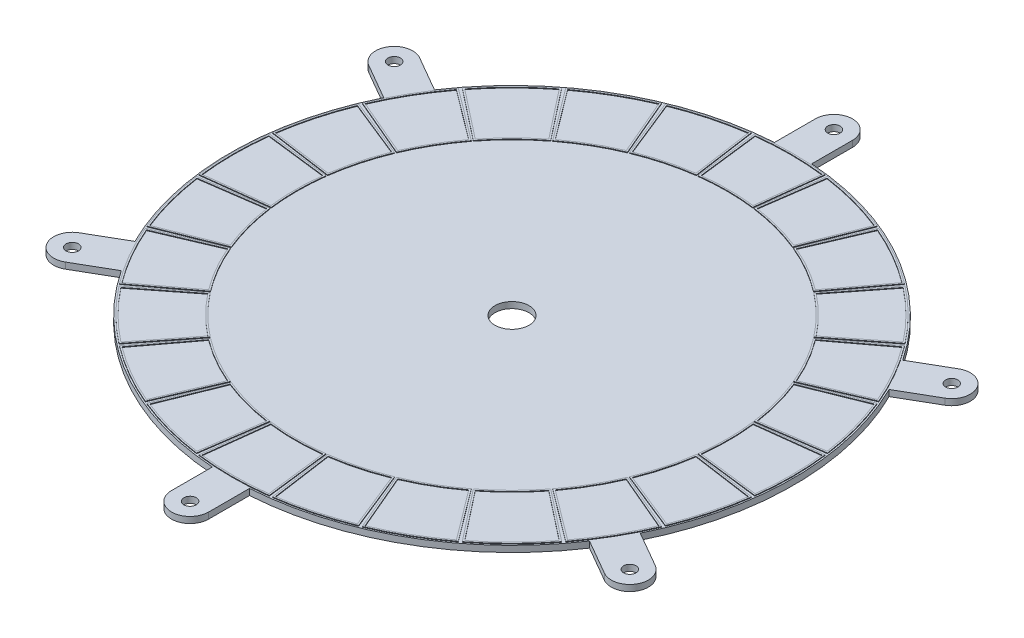
from build123d import *

# Parameters (mm, degrees)
SKETCH1_R           = 10
SKETCH1_R_2         = 27.5
BOSS_EXTRUDE1_DEPTH = 5
BOSS_EXTRUDE3_DEPTH = 1


with BuildPart() as part:
    # Sketch1 → Boss-Extrude1 (new, symmetric)
    with BuildSketch(Plane(origin=(0, 0, 0), x_dir=(1, 0, 0), z_dir=(0, 1, 0))):
        with BuildLine():
            Line((-30, 454.009911786), (-30, 520))
            ThreePointArc((-30, 520), (0, 550), (30, 520))
            Line((30, 520), (30, 454.009911786))
            ThreePointArc((30, 454.009911786), (227.5, 394.041558722), (378.184117177, 252.985718007))
            Line((378.184117177, 252.985718007), (435.333209968, 285.980762114))
            ThreePointArc((435.333209968, 285.980762114), (476.313972081, 275), (465.333209968, 234.019237886))
            Line((465.333209968, 234.019237886), (408.184117177, 201.02419378))
            ThreePointArc((408.184117177, 201.02419378), (455, 0), (408.184117177, -201.02419378))
            Line((408.184117177, -201.02419378), (465.333209968, -234.019237886))
            ThreePointArc((465.333209968, -234.019237886), (476.313972081, -275), (435.333209968, -285.980762114))
            Line((435.333209968, -285.980762114), (378.184117177, -252.985718007))
            ThreePointArc((378.184117177, -252.985718007), (227.5, -394.041558722), (30, -454.009911786))
            Line((30, -454.009911786), (30, -520))
            ThreePointArc((30, -520), (0, -550), (-30, -520))
            Line((-30, -520), (-30, -454.009911786))
            ThreePointArc((-30, -454.009911786), (-227.5, -394.041558722), (-378.184117177, -252.985718007))
            Line((-378.184117177, -252.985718007), (-435.333209968, -285.980762114))
            ThreePointArc((-435.333209968, -285.980762114), (-476.313972081, -275), (-465.333209968, -234.019237886))
            Line((-465.333209968, -234.019237886), (-408.184117177, -201.02419378))
            ThreePointArc((-408.184117177, -201.02419378), (-455, 0), (-408.184117177, 201.02419378))
            Line((-408.184117177, 201.02419378), (-465.333209968, 234.019237886))
            ThreePointArc((-465.333209968, 234.019237886), (-476.313972081, 275), (-435.333209968, 285.980762114))
            Line((-435.333209968, 285.980762114), (-378.184117177, 252.985718007))
            ThreePointArc((-378.184117177, 252.985718007), (-227.5, 394.041558722), (-30, 454.009911786))
        make_face()
        with Locations(Location((0, 520, 0), (0, 0, 270))):
            Circle(SKETCH1_R, mode=Mode.SUBTRACT)
        with Locations(Location((450.333209968, 260, 0), (0, 0, 270))):
            Circle(SKETCH1_R, mode=Mode.SUBTRACT)
        with Locations(Location((450.333209968, -260, 0), (0, 0, 270))):
            Circle(SKETCH1_R, mode=Mode.SUBTRACT)
        with Locations(Location((0, -520, 0), (0, 0, 270))):
            Circle(SKETCH1_R, mode=Mode.SUBTRACT)
        with Locations(Location((-450.333209968, -260, 0), (0, 0, 270))):
            Circle(SKETCH1_R, mode=Mode.SUBTRACT)
        with Locations(Location((-450.333209968, 260, 0), (0, 0, 270))):
            Circle(SKETCH1_R, mode=Mode.SUBTRACT)
        with Locations(Location((0, 0, 0), (0, 0, 270))):
            Circle(SKETCH1_R_2, mode=Mode.SUBTRACT)
    extrude(amount=BOSS_EXTRUDE1_DEPTH, both=True)

    # Sketch3 → Boss-Extrude3 (add)
    # profile 1 of 24: a face of its own
    with BuildSketch(Plane(origin=(0, 5, 0), x_dir=(1, 0, 0), z_dir=(0, 1, 0))):
        with BuildLine():
            Line((-56.781105994, 448.923329759), (-44.180855579, 344.67999942))
            ThreePointArc((-44.180855579, 344.67999942), (0, 347.5), (44.180855579, 344.67999942))
            Line((44.180855579, 344.67999942), (56.781105994, 448.923329759))
            ThreePointArc((56.781105994, 448.923329759), (0, 452.5), (-56.781105994, 448.923329759))
        make_face()
        with BuildLine():
            Line((-54, 446.748251256), (-42, 347.470862088))
            ThreePointArc((-42, 347.470862088), (0, 350), (42, 347.470862088))
            Line((42, 347.470862088), (54, 446.748251256))
            ThreePointArc((54, 446.748251256), (0, 450), (-54, 446.748251256))
        make_face(mode=Mode.SUBTRACT)
    # profile 2 of 24: a face of its own
    with BuildSketch(Plane(origin=(0, 5, 0), x_dir=(1, 0, 0), z_dir=(0, 1, 0))):
        with BuildLine():
            Line((61.343570808, 448.322669871), (46.534318885, 344.370160098))
            ThreePointArc((46.534318885, 344.370160098), (89.939618173, 335.659224635), (131.885177747, 321.500466393))
            Line((131.885177747, 321.500466393), (171.036244257, 418.930606605))
            ThreePointArc((171.036244257, 418.930606605), (117.115617909, 437.081436396), (61.343570808, 448.322669871))
        make_face()
        with BuildLine():
            Line((63.466961172, 445.501902173), (49.363192022, 346.501479468))
            ThreePointArc((49.363192022, 346.501479468), (90.586665786, 338.074039201), (130.500961431, 324.760679679))
            Line((130.500961431, 324.760679679), (167.786950411, 417.549445302))
            ThreePointArc((167.786950411, 417.549445302), (116.468570296, 434.66662183), (63.466961172, 445.501902173))
        make_face(mode=Mode.SUBTRACT)
    # profile 3 of 24: a face of its own
    with BuildSketch(Plane(origin=(0, 5, 0), x_dir=(1, 0, 0), z_dir=(0, 1, 0))):
        with BuildLine():
            Line((175.287784634, 417.16956092), (134.078256418, 320.592063464))
            ThreePointArc((134.078256418, 320.592063464), (173.75, 300.943827815), (210.601743002, 276.411207885))
            Line((210.601743002, 276.411207885), (273.635545125, 360.388454926))
            ThreePointArc((273.635545125, 360.388454926), (226.25, 391.876495212), (175.287784634, 417.16956092))
        make_face()
        with BuildLine():
            Line((176.608753823, 413.895334684), (137.362364085, 321.918593643))
            ThreePointArc((137.362364085, 321.918593643), (175, 303.108891325), (210.108498003, 279.918593643))
            Line((210.108498003, 279.918593643), (270.139497432, 359.895334684))
            ThreePointArc((270.139497432, 359.895334684), (225, 389.711431703), (176.608753823, 413.895334684))
        make_face(mode=Mode.SUBTRACT)
    # profile 4 of 24: a face of its own
    with BuildSketch(Plane(origin=(0, 5, 0), x_dir=(1, 0, 0), z_dir=(0, 1, 0))):
        with BuildLine():
            Line((277.286425614, 357.587035797), (212.484982351, 274.966147508))
            ThreePointArc((212.484982351, 274.966147508), (245.719606462, 245.719606462), (274.966147508, 212.484982351))
            Line((274.966147508, 212.484982351), (357.587035797, 277.286425614))
            ThreePointArc((357.587035797, 277.286425614), (319.965818487, 319.965818487), (277.286425614, 357.587035797))
        make_face()
        with BuildLine():
            Line((277.714951762, 354.08248413), (216.000518037, 275.397487657))
            ThreePointArc((216.000518037, 275.397487657), (247.487373415, 247.487373415), (275.397487657, 216.000518037))
            Line((275.397487657, 216.000518037), (354.08248413, 277.714951762))
            ThreePointArc((354.08248413, 277.714951762), (318.198051534, 318.198051534), (277.714951762, 354.08248413))
        make_face(mode=Mode.SUBTRACT)
    # profile 5 of 24: a face of its own
    with BuildSketch(Plane(origin=(0, 5, 0), x_dir=(1, 0, 0), z_dir=(0, 1, 0))):
        with BuildLine():
            Line((360.388454926, 273.635545125), (276.411207885, 210.601743002))
            ThreePointArc((276.411207885, 210.601743002), (300.943827815, 173.75), (320.592063464, 134.078256418))
            Line((320.592063464, 134.078256418), (417.16956092, 175.287784634))
            ThreePointArc((417.16956092, 175.287784634), (391.876495212, 226.25), (360.388454926, 273.635545125))
        make_face()
        with BuildLine():
            Line((359.895334684, 270.139497432), (279.918593643, 210.108498003))
            ThreePointArc((279.918593643, 210.108498003), (303.108891325, 175), (321.918593643, 137.362364085))
            Line((321.918593643, 137.362364085), (413.895334684, 176.608753823))
            ThreePointArc((413.895334684, 176.608753823), (389.711431703, 225), (359.895334684, 270.139497432))
        make_face(mode=Mode.SUBTRACT)
    # profile 6 of 24: a face of its own
    with BuildSketch(Plane(origin=(0, 5, 0), x_dir=(1, 0, 0), z_dir=(0, 1, 0))):
        with BuildLine():
            Line((418.930606605, 171.036244257), (321.500466393, 131.885177747))
            ThreePointArc((321.500466393, 131.885177747), (335.659224635, 89.939618173), (344.370160098, 46.534318885))
            Line((344.370160098, 46.534318885), (448.322669871, 61.343570808))
            ThreePointArc((448.322669871, 61.343570808), (437.081436396, 117.115617909), (418.930606605, 171.036244257))
        make_face()
        with BuildLine():
            Line((417.549445302, 167.786950411), (324.760679679, 130.500961431))
            ThreePointArc((324.760679679, 130.500961431), (338.074039201, 90.586665786), (346.501479468, 49.363192022))
            Line((346.501479468, 49.363192022), (445.501902173, 63.466961172))
            ThreePointArc((445.501902173, 63.466961172), (434.66662183, 116.468570296), (417.549445302, 167.786950411))
        make_face(mode=Mode.SUBTRACT)
    # profile 7 of 24: a face of its own
    with BuildSketch(Plane(origin=(0, 5, 0), x_dir=(1, 0, 0), z_dir=(0, 1, 0))):
        with BuildLine():
            Line((448.923329759, 56.781105994), (344.67999942, 44.180855579))
            ThreePointArc((344.67999942, 44.180855579), (347.5, 0), (344.67999942, -44.180855579))
            Line((344.67999942, -44.180855579), (448.923329759, -56.781105994))
            ThreePointArc((448.923329759, -56.781105994), (452.5, 0), (448.923329759, 56.781105994))
        make_face()
        with BuildLine():
            Line((446.748251256, 54), (347.470862088, 42))
            ThreePointArc((347.470862088, 42), (350, 0), (347.470862088, -42))
            Line((347.470862088, -42), (446.748251256, -54))
            ThreePointArc((446.748251256, -54), (450, 0), (446.748251256, 54))
        make_face(mode=Mode.SUBTRACT)
    # profile 8 of 24: a face of its own
    with BuildSketch(Plane(origin=(0, 5, 0), x_dir=(1, 0, 0), z_dir=(0, 1, 0))):
        with BuildLine():
            Line((448.322669871, -61.343570808), (344.370160098, -46.534318885))
            ThreePointArc((344.370160098, -46.534318885), (335.659224635, -89.939618173), (321.500466393, -131.885177747))
            Line((321.500466393, -131.885177747), (418.930606605, -171.036244257))
            ThreePointArc((418.930606605, -171.036244257), (437.081436396, -117.115617909), (448.322669871, -61.343570808))
        make_face()
        with BuildLine():
            Line((445.501902173, -63.466961172), (346.501479468, -49.363192022))
            ThreePointArc((346.501479468, -49.363192022), (338.074039201, -90.586665786), (324.760679679, -130.500961431))
            Line((324.760679679, -130.500961431), (417.549445302, -167.786950411))
            ThreePointArc((417.549445302, -167.786950411), (434.66662183, -116.468570296), (445.501902173, -63.466961172))
        make_face(mode=Mode.SUBTRACT)
    # profile 9 of 24: a face of its own
    with BuildSketch(Plane(origin=(0, 5, 0), x_dir=(1, 0, 0), z_dir=(0, 1, 0))):
        with BuildLine():
            Line((417.16956092, -175.287784634), (320.592063464, -134.078256418))
            ThreePointArc((320.592063464, -134.078256418), (300.943827815, -173.75), (276.411207885, -210.601743002))
            Line((276.411207885, -210.601743002), (360.388454926, -273.635545125))
            ThreePointArc((360.388454926, -273.635545125), (391.876495212, -226.25), (417.16956092, -175.287784634))
        make_face()
        with BuildLine():
            Line((413.895334684, -176.608753823), (321.918593643, -137.362364085))
            ThreePointArc((321.918593643, -137.362364085), (303.108891325, -175), (279.918593643, -210.108498003))
            Line((279.918593643, -210.108498003), (359.895334684, -270.139497432))
            ThreePointArc((359.895334684, -270.139497432), (389.711431703, -225), (413.895334684, -176.608753823))
        make_face(mode=Mode.SUBTRACT)
    # profile 10 of 24: a face of its own
    with BuildSketch(Plane(origin=(0, 5, 0), x_dir=(1, 0, 0), z_dir=(0, 1, 0))):
        with BuildLine():
            Line((357.587035797, -277.286425614), (274.966147508, -212.484982351))
            ThreePointArc((274.966147508, -212.484982351), (245.719606462, -245.719606462), (212.484982351, -274.966147508))
            Line((212.484982351, -274.966147508), (277.286425614, -357.587035797))
            ThreePointArc((277.286425614, -357.587035797), (319.965818487, -319.965818487), (357.587035797, -277.286425614))
        make_face()
        with BuildLine():
            Line((354.08248413, -277.714951762), (275.397487657, -216.000518037))
            ThreePointArc((275.397487657, -216.000518037), (247.487373415, -247.487373415), (216.000518037, -275.397487657))
            Line((216.000518037, -275.397487657), (277.714951762, -354.08248413))
            ThreePointArc((277.714951762, -354.08248413), (318.198051534, -318.198051534), (354.08248413, -277.714951762))
        make_face(mode=Mode.SUBTRACT)
    # profile 11 of 24: a face of its own
    with BuildSketch(Plane(origin=(0, 5, 0), x_dir=(1, 0, 0), z_dir=(0, 1, 0))):
        with BuildLine():
            Line((273.635545125, -360.388454926), (210.601743002, -276.411207885))
            ThreePointArc((210.601743002, -276.411207885), (173.75, -300.943827815), (134.078256418, -320.592063464))
            Line((134.078256418, -320.592063464), (175.287784634, -417.16956092))
            ThreePointArc((175.287784634, -417.16956092), (226.25, -391.876495212), (273.635545125, -360.388454926))
        make_face()
        with BuildLine():
            Line((270.139497432, -359.895334684), (210.108498003, -279.918593643))
            ThreePointArc((210.108498003, -279.918593643), (175, -303.108891325), (137.362364085, -321.918593643))
            Line((137.362364085, -321.918593643), (176.608753823, -413.895334684))
            ThreePointArc((176.608753823, -413.895334684), (225, -389.711431703), (270.139497432, -359.895334684))
        make_face(mode=Mode.SUBTRACT)
    # profile 12 of 24: a face of its own
    with BuildSketch(Plane(origin=(0, 5, 0), x_dir=(1, 0, 0), z_dir=(0, 1, 0))):
        with BuildLine():
            Line((171.036244257, -418.930606605), (131.885177747, -321.500466393))
            ThreePointArc((131.885177747, -321.500466393), (89.939618173, -335.659224635), (46.534318885, -344.370160098))
            Line((46.534318885, -344.370160098), (61.343570808, -448.322669871))
            ThreePointArc((61.343570808, -448.322669871), (117.115617909, -437.081436396), (171.036244257, -418.930606605))
        make_face()
        with BuildLine():
            Line((167.786950411, -417.549445302), (130.500961431, -324.760679679))
            ThreePointArc((130.500961431, -324.760679679), (90.586665786, -338.074039201), (49.363192022, -346.501479468))
            Line((49.363192022, -346.501479468), (63.466961172, -445.501902173))
            ThreePointArc((63.466961172, -445.501902173), (116.468570296, -434.66662183), (167.786950411, -417.549445302))
        make_face(mode=Mode.SUBTRACT)
    # profile 13 of 24: a face of its own
    with BuildSketch(Plane(origin=(0, 5, 0), x_dir=(1, 0, 0), z_dir=(0, 1, 0))):
        with BuildLine():
            Line((56.781105994, -448.923329759), (44.180855579, -344.67999942))
            ThreePointArc((44.180855579, -344.67999942), (0, -347.5), (-44.180855579, -344.67999942))
            Line((-44.180855579, -344.67999942), (-56.781105994, -448.923329759))
            ThreePointArc((-56.781105994, -448.923329759), (0, -452.5), (56.781105994, -448.923329759))
        make_face()
        with BuildLine():
            Line((54, -446.748251256), (42, -347.470862088))
            ThreePointArc((42, -347.470862088), (0, -350), (-42, -347.470862088))
            Line((-42, -347.470862088), (-54, -446.748251256))
            ThreePointArc((-54, -446.748251256), (0, -450), (54, -446.748251256))
        make_face(mode=Mode.SUBTRACT)
    # profile 14 of 24: a face of its own
    with BuildSketch(Plane(origin=(0, 5, 0), x_dir=(1, 0, 0), z_dir=(0, 1, 0))):
        with BuildLine():
            Line((-61.343570808, -448.322669871), (-46.534318885, -344.370160098))
            ThreePointArc((-46.534318885, -344.370160098), (-89.939618173, -335.659224635), (-131.885177747, -321.500466393))
            Line((-131.885177747, -321.500466393), (-171.036244257, -418.930606605))
            ThreePointArc((-171.036244257, -418.930606605), (-117.115617909, -437.081436396), (-61.343570808, -448.322669871))
        make_face()
        with BuildLine():
            Line((-63.466961172, -445.501902173), (-49.363192022, -346.501479468))
            ThreePointArc((-49.363192022, -346.501479468), (-90.586665786, -338.074039201), (-130.500961431, -324.760679679))
            Line((-130.500961431, -324.760679679), (-167.786950411, -417.549445302))
            ThreePointArc((-167.786950411, -417.549445302), (-116.468570296, -434.66662183), (-63.466961172, -445.501902173))
        make_face(mode=Mode.SUBTRACT)
    # profile 15 of 24: a face of its own
    with BuildSketch(Plane(origin=(0, 5, 0), x_dir=(1, 0, 0), z_dir=(0, 1, 0))):
        with BuildLine():
            Line((-175.287784634, -417.16956092), (-134.078256418, -320.592063464))
            ThreePointArc((-134.078256418, -320.592063464), (-173.75, -300.943827815), (-210.601743002, -276.411207885))
            Line((-210.601743002, -276.411207885), (-273.635545125, -360.388454926))
            ThreePointArc((-273.635545125, -360.388454926), (-226.25, -391.876495212), (-175.287784634, -417.16956092))
        make_face()
        with BuildLine():
            Line((-176.608753823, -413.895334684), (-137.362364085, -321.918593643))
            ThreePointArc((-137.362364085, -321.918593643), (-175, -303.108891325), (-210.108498003, -279.918593643))
            Line((-210.108498003, -279.918593643), (-270.139497432, -359.895334684))
            ThreePointArc((-270.139497432, -359.895334684), (-225, -389.711431703), (-176.608753823, -413.895334684))
        make_face(mode=Mode.SUBTRACT)
    # profile 16 of 24: a face of its own
    with BuildSketch(Plane(origin=(0, 5, 0), x_dir=(1, 0, 0), z_dir=(0, 1, 0))):
        with BuildLine():
            Line((-277.286425614, -357.587035797), (-212.484982351, -274.966147508))
            ThreePointArc((-212.484982351, -274.966147508), (-245.719606462, -245.719606462), (-274.966147508, -212.484982351))
            Line((-274.966147508, -212.484982351), (-357.587035797, -277.286425614))
            ThreePointArc((-357.587035797, -277.286425614), (-319.965818487, -319.965818487), (-277.286425614, -357.587035797))
        make_face()
        with BuildLine():
            Line((-277.714951762, -354.08248413), (-216.000518037, -275.397487657))
            ThreePointArc((-216.000518037, -275.397487657), (-247.487373415, -247.487373415), (-275.397487657, -216.000518037))
            Line((-275.397487657, -216.000518037), (-354.08248413, -277.714951762))
            ThreePointArc((-354.08248413, -277.714951762), (-318.198051534, -318.198051534), (-277.714951762, -354.08248413))
        make_face(mode=Mode.SUBTRACT)
    # profile 17 of 24: a face of its own
    with BuildSketch(Plane(origin=(0, 5, 0), x_dir=(1, 0, 0), z_dir=(0, 1, 0))):
        with BuildLine():
            Line((-360.388454926, -273.635545125), (-276.411207885, -210.601743002))
            ThreePointArc((-276.411207885, -210.601743002), (-300.943827815, -173.75), (-320.592063464, -134.078256418))
            Line((-320.592063464, -134.078256418), (-417.16956092, -175.287784634))
            ThreePointArc((-417.16956092, -175.287784634), (-391.876495212, -226.25), (-360.388454926, -273.635545125))
        make_face()
        with BuildLine():
            Line((-359.895334684, -270.139497432), (-279.918593643, -210.108498003))
            ThreePointArc((-279.918593643, -210.108498003), (-303.108891325, -175), (-321.918593643, -137.362364085))
            Line((-321.918593643, -137.362364085), (-413.895334684, -176.608753823))
            ThreePointArc((-413.895334684, -176.608753823), (-389.711431703, -225), (-359.895334684, -270.139497432))
        make_face(mode=Mode.SUBTRACT)
    # profile 18 of 24: a face of its own
    with BuildSketch(Plane(origin=(0, 5, 0), x_dir=(1, 0, 0), z_dir=(0, 1, 0))):
        with BuildLine():
            Line((-418.930606605, -171.036244257), (-321.500466393, -131.885177747))
            ThreePointArc((-321.500466393, -131.885177747), (-335.659224635, -89.939618173), (-344.370160098, -46.534318885))
            Line((-344.370160098, -46.534318885), (-448.322669871, -61.343570808))
            ThreePointArc((-448.322669871, -61.343570808), (-437.081436396, -117.115617909), (-418.930606605, -171.036244257))
        make_face()
        with BuildLine():
            Line((-417.549445302, -167.786950411), (-324.760679679, -130.500961431))
            ThreePointArc((-324.760679679, -130.500961431), (-338.074039201, -90.586665786), (-346.501479468, -49.363192022))
            Line((-346.501479468, -49.363192022), (-445.501902173, -63.466961172))
            ThreePointArc((-445.501902173, -63.466961172), (-434.66662183, -116.468570296), (-417.549445302, -167.786950411))
        make_face(mode=Mode.SUBTRACT)
    # profile 19 of 24: a face of its own
    with BuildSketch(Plane(origin=(0, 5, 0), x_dir=(1, 0, 0), z_dir=(0, 1, 0))):
        with BuildLine():
            Line((-448.923329759, -56.781105994), (-344.67999942, -44.180855579))
            ThreePointArc((-344.67999942, -44.180855579), (-347.5, 0), (-344.67999942, 44.180855579))
            Line((-344.67999942, 44.180855579), (-448.923329759, 56.781105994))
            ThreePointArc((-448.923329759, 56.781105994), (-452.5, 0), (-448.923329759, -56.781105994))
        make_face()
        with BuildLine():
            Line((-446.748251256, -54), (-347.470862088, -42))
            ThreePointArc((-347.470862088, -42), (-350, 0), (-347.470862088, 42))
            Line((-347.470862088, 42), (-446.748251256, 54))
            ThreePointArc((-446.748251256, 54), (-450, 0), (-446.748251256, -54))
        make_face(mode=Mode.SUBTRACT)
    # profile 20 of 24: a face of its own
    with BuildSketch(Plane(origin=(0, 5, 0), x_dir=(1, 0, 0), z_dir=(0, 1, 0))):
        with BuildLine():
            Line((-448.322669871, 61.343570808), (-344.370160098, 46.534318885))
            ThreePointArc((-344.370160098, 46.534318885), (-335.659224635, 89.939618173), (-321.500466393, 131.885177747))
            Line((-321.500466393, 131.885177747), (-418.930606605, 171.036244257))
            ThreePointArc((-418.930606605, 171.036244257), (-437.081436396, 117.115617909), (-448.322669871, 61.343570808))
        make_face()
        with BuildLine():
            Line((-445.501902173, 63.466961172), (-346.501479468, 49.363192022))
            ThreePointArc((-346.501479468, 49.363192022), (-338.074039201, 90.586665786), (-324.760679679, 130.500961431))
            Line((-324.760679679, 130.500961431), (-417.549445302, 167.786950411))
            ThreePointArc((-417.549445302, 167.786950411), (-434.66662183, 116.468570296), (-445.501902173, 63.466961172))
        make_face(mode=Mode.SUBTRACT)
    # profile 21 of 24: a face of its own
    with BuildSketch(Plane(origin=(0, 5, 0), x_dir=(1, 0, 0), z_dir=(0, 1, 0))):
        with BuildLine():
            Line((-417.16956092, 175.287784634), (-320.592063464, 134.078256418))
            ThreePointArc((-320.592063464, 134.078256418), (-300.943827815, 173.75), (-276.411207885, 210.601743002))
            Line((-276.411207885, 210.601743002), (-360.388454926, 273.635545125))
            ThreePointArc((-360.388454926, 273.635545125), (-391.876495212, 226.25), (-417.16956092, 175.287784634))
        make_face()
        with BuildLine():
            Line((-413.895334684, 176.608753823), (-321.918593643, 137.362364085))
            ThreePointArc((-321.918593643, 137.362364085), (-303.108891325, 175), (-279.918593643, 210.108498003))
            Line((-279.918593643, 210.108498003), (-359.895334684, 270.139497432))
            ThreePointArc((-359.895334684, 270.139497432), (-389.711431703, 225), (-413.895334684, 176.608753823))
        make_face(mode=Mode.SUBTRACT)
    # profile 22 of 24: a face of its own
    with BuildSketch(Plane(origin=(0, 5, 0), x_dir=(1, 0, 0), z_dir=(0, 1, 0))):
        with BuildLine():
            Line((-357.587035797, 277.286425614), (-274.966147508, 212.484982351))
            ThreePointArc((-274.966147508, 212.484982351), (-245.719606462, 245.719606462), (-212.484982351, 274.966147508))
            Line((-212.484982351, 274.966147508), (-277.286425614, 357.587035797))
            ThreePointArc((-277.286425614, 357.587035797), (-319.965818487, 319.965818487), (-357.587035797, 277.286425614))
        make_face()
        with BuildLine():
            Line((-354.08248413, 277.714951762), (-275.397487657, 216.000518037))
            ThreePointArc((-275.397487657, 216.000518037), (-247.487373415, 247.487373415), (-216.000518037, 275.397487657))
            Line((-216.000518037, 275.397487657), (-277.714951762, 354.08248413))
            ThreePointArc((-277.714951762, 354.08248413), (-318.198051534, 318.198051534), (-354.08248413, 277.714951762))
        make_face(mode=Mode.SUBTRACT)
    # profile 23 of 24: a face of its own
    with BuildSketch(Plane(origin=(0, 5, 0), x_dir=(1, 0, 0), z_dir=(0, 1, 0))):
        with BuildLine():
            Line((-273.635545125, 360.388454926), (-210.601743002, 276.411207885))
            ThreePointArc((-210.601743002, 276.411207885), (-173.75, 300.943827815), (-134.078256418, 320.592063464))
            Line((-134.078256418, 320.592063464), (-175.287784634, 417.16956092))
            ThreePointArc((-175.287784634, 417.16956092), (-226.25, 391.876495212), (-273.635545125, 360.388454926))
        make_face()
        with BuildLine():
            Line((-270.139497432, 359.895334684), (-210.108498003, 279.918593643))
            ThreePointArc((-210.108498003, 279.918593643), (-175, 303.108891325), (-137.362364085, 321.918593643))
            Line((-137.362364085, 321.918593643), (-176.608753823, 413.895334684))
            ThreePointArc((-176.608753823, 413.895334684), (-225, 389.711431703), (-270.139497432, 359.895334684))
        make_face(mode=Mode.SUBTRACT)
    # profile 24 of 24: a face of its own
    with BuildSketch(Plane(origin=(0, 5, 0), x_dir=(1, 0, 0), z_dir=(0, 1, 0))):
        with BuildLine():
            Line((-171.036244257, 418.930606605), (-131.885177747, 321.500466393))
            ThreePointArc((-131.885177747, 321.500466393), (-89.939618173, 335.659224635), (-46.534318885, 344.370160098))
            Line((-46.534318885, 344.370160098), (-61.343570808, 448.322669871))
            ThreePointArc((-61.343570808, 448.322669871), (-117.115617909, 437.081436396), (-171.036244257, 418.930606605))
        make_face()
        with BuildLine():
            Line((-167.786950411, 417.549445302), (-130.500961431, 324.760679679))
            ThreePointArc((-130.500961431, 324.760679679), (-90.586665786, 338.074039201), (-49.363192022, 346.501479468))
            Line((-49.363192022, 346.501479468), (-63.466961172, 445.501902173))
            ThreePointArc((-63.466961172, 445.501902173), (-116.468570296, 434.66662183), (-167.786950411, 417.549445302))
        make_face(mode=Mode.SUBTRACT)
    extrude(amount=BOSS_EXTRUDE3_DEPTH)


solid = part.part
